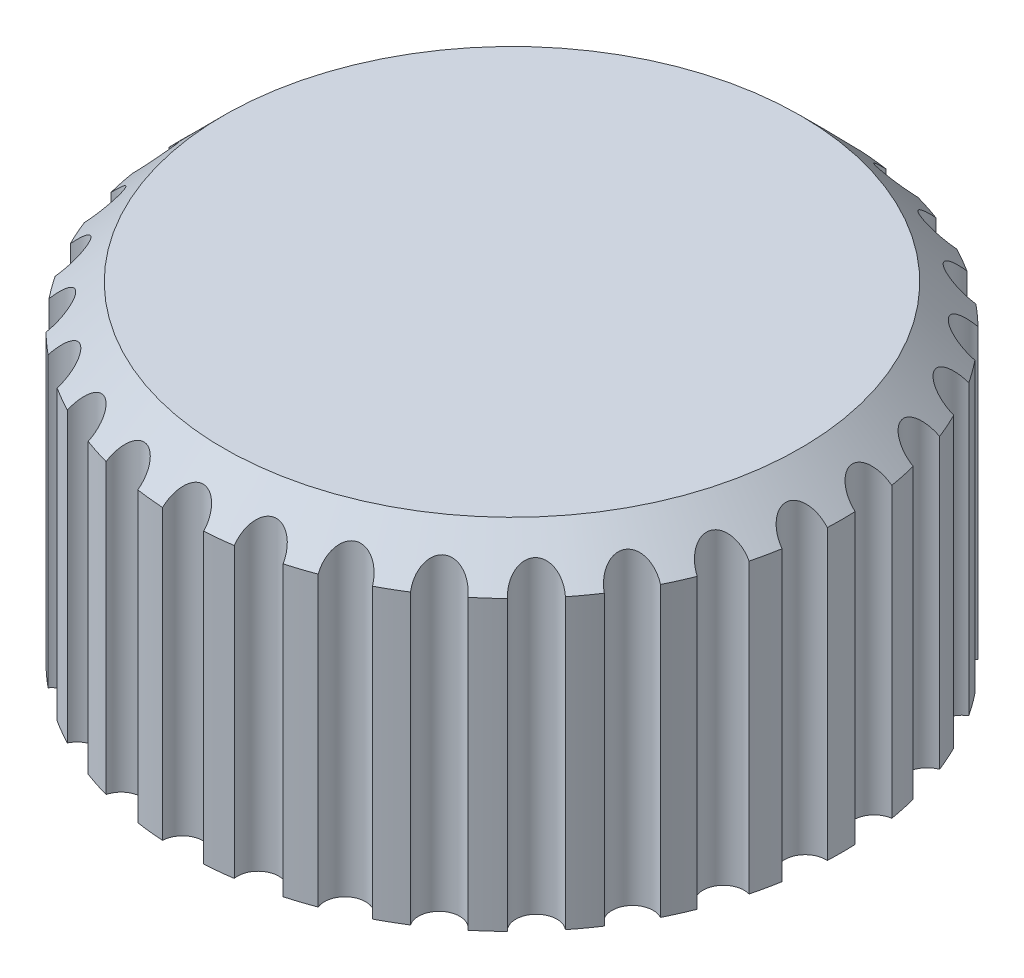
from build123d import *

# Parameters (mm, degrees)
BOSS_EXTRUDE2_DEPTH = 16
SKETCH3_R           = 12.5
CUT_EXTRUDE1_DEPTH  = 12
SKETCH4_R           = 7
BOSS_EXTRUDE3_DEPTH = 8
FILLET2_R           = 1


with BuildPart() as part:
    # Sketch1 → Boss-Extrude2 (new body)
    with BuildSketch(Plane(origin=(0, 0, 0), x_dir=(1, 0, 0), z_dir=(0, 1, 0))):
        with BuildLine():
            ThreePointArc((15.985748928, -0.675152727), (15.996436835, -0.337651558), (16, 0))
            ThreePointArc((16, 0), (15.996436835, 0.337651558), (15.985748928, 0.675152727))
            ThreePointArc((15.985748928, 0.675152727), (14.917828431, 1.567926949), (15.776794105, 2.663225068))
            ThreePointArc((15.776794105, 2.663225068), (15.650361612, 3.326587053), (15.496049815, 3.984023109))
            ThreePointArc((15.496049815, 3.984023109), (14.265847744, 4.635254916), (14.878317674, 5.885207149))
            ThreePointArc((14.878317674, 5.885207149), (14.616727322, 6.507786289), (14.329098966, 7.118772563))
            ThreePointArc((14.329098966, 7.118772563), (12.990381057, 7.5), (13.329587367, 8.849977437))
            ThreePointArc((13.329587367, 8.849977437), (12.94427191, 9.404564037), (12.535897734, 9.942397497))
            ThreePointArc((12.535897734, 9.942397497), (11.147172382, 10.036959095), (11.198290129, 11.427961243))
            ThreePointArc((11.198290129, 11.427961243), (10.706089702, 11.890317208), (10.194817618, 12.331491951))
            ThreePointArc((10.194817618, 12.331491951), (8.816778784, 12.135254916), (8.577573877, 13.506488307))
            ThreePointArc((8.577573877, 13.506488307), (8, 13.856406461), (7.408175051, 14.181641034))
            ThreePointArc((7.408175051, 14.181641034), (6.101049646, 13.703181865), (5.581976488, 14.994717019))
            ThreePointArc((5.581976488, 14.994717019), (4.94427191, 15.216904261), (4.297759686, 15.411984353))
            ThreePointArc((4.297759686, 15.411984353), (3.118675362, 14.672214011), (2.34241994, 15.827604646))
            ThreePointArc((2.34241994, 15.827604646), (1.672455412, 15.912350326), (0.999511599, 15.96875))
            ThreePointArc((0.999511599, 15.96875), (0, 15), (-0.999511599, 15.96875))
            ThreePointArc((-0.999511599, 15.96875), (-1.672455412, 15.912350326), (-2.34241994, 15.827604646))
            ThreePointArc((-2.34241994, 15.827604646), (-2.33055314, 15.739336009), (-2.326587053, 15.650361612))
            ThreePointArc((-2.326587053, 15.650361612), (-3.206530051, 14.657594612), (-4.297759686, 15.411984353))
            ThreePointArc((-4.297759686, 15.411984353), (-4.94427191, 15.216904261), (-5.581976488, 14.994717019))
            ThreePointArc((-5.581976488, 14.994717019), (-5.526509111, 14.809328203), (-5.507786289, 14.616727322))
            ThreePointArc((-5.507786289, 14.616727322), (-6.284614563, 13.641948178), (-7.408175051, 14.181641034))
            ThreePointArc((-7.408175051, 14.181641034), (-8, 13.856406461), (-8.577573877, 13.506488307))
            ThreePointArc((-8.577573877, 13.506488307), (-8.448794671, 13.238389098), (-8.404564037, 12.94427191))
            ThreePointArc((-8.404564037, 12.94427191), (-9.080722703, 11.998160505), (-10.194817618, 12.331491951))
            ThreePointArc((-10.194817618, 12.331491951), (-10.706089702, 11.890317208), (-11.198290129, 11.427961243))
            ThreePointArc((-11.198290129, 11.427961243), (-10.970527265, 11.098500788), (-10.890317208, 10.706089702))
            ThreePointArc((-10.890317208, 10.706089702), (-11.469354339, 9.799011831), (-12.535897734, 9.942397497))
            ThreePointArc((-12.535897734, 9.942397497), (-12.94427191, 9.404564037), (-13.329587367, 8.849977437))
            ThreePointArc((-13.329587367, 8.849977437), (-12.982673351, 8.486405647), (-12.856406461, 8))
            ThreePointArc((-12.856406461, 8), (-13.342934215, 7.141893799), (-14.329098966, 7.118772563))
            ThreePointArc((-14.329098966, 7.118772563), (-14.616727322, 6.507786289), (-14.878317674, 5.885207149))
            ThreePointArc((-14.878317674, 5.885207149), (-14.398800787, 5.519342955), (-14.216904261, 4.94427191))
            ThreePointArc((-14.216904261, 4.94427191), (-14.616548347, 4.144538969), (-15.496049815, 3.984023109))
            ThreePointArc((-15.496049815, 3.984023109), (-15.650361612, 3.326587053), (-15.776794105, 2.663225068))
            ThreePointArc((-15.776794105, 2.663225068), (-15.158839801, 2.329891257), (-14.912350326, 1.672455412))
            ThreePointArc((-14.912350326, 1.672455412), (-15.23168837, 0.939857773), (-15.985748928, 0.675152727))
            ThreePointArc((-15.985748928, 0.675152727), (-16, 0), (-15.985748928, -0.675152727))
            ThreePointArc((-15.985748928, -0.675152727), (-15.23168837, -0.939857773), (-14.912350326, -1.672455412))
            ThreePointArc((-14.912350326, -1.672455412), (-15.158839801, -2.329891257), (-15.776794105, -2.663225068))
            ThreePointArc((-15.776794105, -2.663225068), (-15.650361612, -3.326587053), (-15.496049815, -3.984023109))
            ThreePointArc((-15.496049815, -3.984023109), (-14.616548347, -4.144538969), (-14.216904261, -4.94427191))
            ThreePointArc((-14.216904261, -4.94427191), (-14.398800787, -5.519342955), (-14.878317674, -5.885207149))
            ThreePointArc((-14.878317674, -5.885207149), (-14.616727322, -6.507786289), (-14.329098966, -7.118772563))
            ThreePointArc((-14.329098966, -7.118772563), (-13.342934215, -7.141893799), (-12.856406461, -8))
            ThreePointArc((-12.856406461, -8), (-12.982673351, -8.486405647), (-13.329587367, -8.849977437))
            ThreePointArc((-13.329587367, -8.849977437), (-12.94427191, -9.404564037), (-12.535897734, -9.942397497))
            ThreePointArc((-12.535897734, -9.942397497), (-11.469354339, -9.799011831), (-10.890317208, -10.706089702))
            ThreePointArc((-10.890317208, -10.706089702), (-10.970527265, -11.098500788), (-11.198290129, -11.427961243))
            ThreePointArc((-11.198290129, -11.427961243), (-10.706089702, -11.890317208), (-10.194817618, -12.331491951))
            ThreePointArc((-10.194817618, -12.331491951), (-9.080722703, -11.998160505), (-8.404564037, -12.94427191))
            ThreePointArc((-8.404564037, -12.94427191), (-8.448794671, -13.238389098), (-8.577573877, -13.506488307))
            ThreePointArc((-8.577573877, -13.506488307), (-8, -13.856406461), (-7.408175051, -14.181641034))
            ThreePointArc((-7.408175051, -14.181641034), (-6.284614563, -13.641948178), (-5.507786289, -14.616727322))
            ThreePointArc((-5.507786289, -14.616727322), (-5.526509111, -14.809328203), (-5.581976488, -14.994717019))
            ThreePointArc((-5.581976488, -14.994717019), (-4.94427191, -15.216904261), (-4.297759686, -15.411984353))
            ThreePointArc((-4.297759686, -15.411984353), (-3.206530051, -14.657594612), (-2.326587053, -15.650361612))
            ThreePointArc((-2.326587053, -15.650361612), (-2.33055314, -15.739336009), (-2.34241994, -15.827604646))
            ThreePointArc((-2.34241994, -15.827604646), (-1.672455412, -15.912350326), (-0.999511599, -15.96875))
            ThreePointArc((-0.999511599, -15.96875), (0, -15), (0.999511599, -15.96875))
            ThreePointArc((0.999511599, -15.96875), (1.672455412, -15.912350326), (2.34241994, -15.827604646))
            ThreePointArc((2.34241994, -15.827604646), (3.118675362, -14.672214011), (4.297759686, -15.411984353))
            ThreePointArc((4.297759686, -15.411984353), (4.94427191, -15.216904261), (5.581976488, -14.994717019))
            ThreePointArc((5.581976488, -14.994717019), (6.101049646, -13.703181865), (7.408175051, -14.181641034))
            ThreePointArc((7.408175051, -14.181641034), (8, -13.856406461), (8.577573877, -13.506488307))
            ThreePointArc((8.577573877, -13.506488307), (8.816778784, -12.135254916), (10.194817618, -12.331491951))
            ThreePointArc((10.194817618, -12.331491951), (10.706089702, -11.890317208), (11.198290129, -11.427961243))
            ThreePointArc((11.198290129, -11.427961243), (11.147172382, -10.036959095), (12.535897734, -9.942397497))
            ThreePointArc((12.535897734, -9.942397497), (12.94427191, -9.404564037), (13.329587367, -8.849977437))
            ThreePointArc((13.329587367, -8.849977437), (12.990381057, -7.5), (14.329098966, -7.118772563))
            ThreePointArc((14.329098966, -7.118772563), (14.616727322, -6.507786289), (14.878317674, -5.885207149))
            ThreePointArc((14.878317674, -5.885207149), (14.265847744, -4.635254916), (15.496049815, -3.984023109))
            ThreePointArc((15.496049815, -3.984023109), (15.650361612, -3.326587053), (15.776794105, -2.663225068))
            ThreePointArc((15.776794105, -2.663225068), (14.917828431, -1.567926949), (15.985748928, -0.675152727))
        make_face()
    extrude(amount=BOSS_EXTRUDE2_DEPTH)

    # Sketch2 → Cut-Revolve1 (revolve, cut)
    with BuildSketch(Plane.XY, mode=Mode.PRIVATE) as cut_revolve1_sk:
        Polygon((-16, 16), (-16, 14), (-14, 16), align=None)
    revolve(cut_revolve1_sk.sketch.rotate(Axis((0, 0, 0), (0, 1, 0)), 270), axis=Axis((0, 0, 0), (0, 1, 0)), mode=Mode.SUBTRACT)

    # Sketch3 → Cut-Extrude1 (cut)
    with BuildSketch(Plane.XZ):
        with Locations(Location((0, 0, 0), (0, 0, 270))):
            Circle(SKETCH3_R)
    extrude(amount=-CUT_EXTRUDE1_DEPTH, mode=Mode.SUBTRACT)

    # Sketch4 → Boss-Extrude3 (add)
    with BuildSketch(Plane.XZ.offset(-12)):
        with Locations(Location((0, 0, 0), (0, 0, 90))):
            Circle(SKETCH4_R)
        with BuildLine():
            Line((2.598076211, -1.5), (-2.598076211, -1.5))
            ThreePointArc((-2.598076211, -1.5), (0, 3), (2.598076211, -1.5))
        make_face(mode=Mode.SUBTRACT)
    extrude(amount=BOSS_EXTRUDE3_DEPTH)

    # Fillet2
    fillet2_edges = [part.edges().sort_by_distance(p)[0] for p in [
        (0, 0, 12.5),
        (0, 12, 12.5),
        (0, 4, -7),
        (0, 12, -7),
    ]]
    fillet(fillet2_edges, radius=FILLET2_R)


solid = part.part
